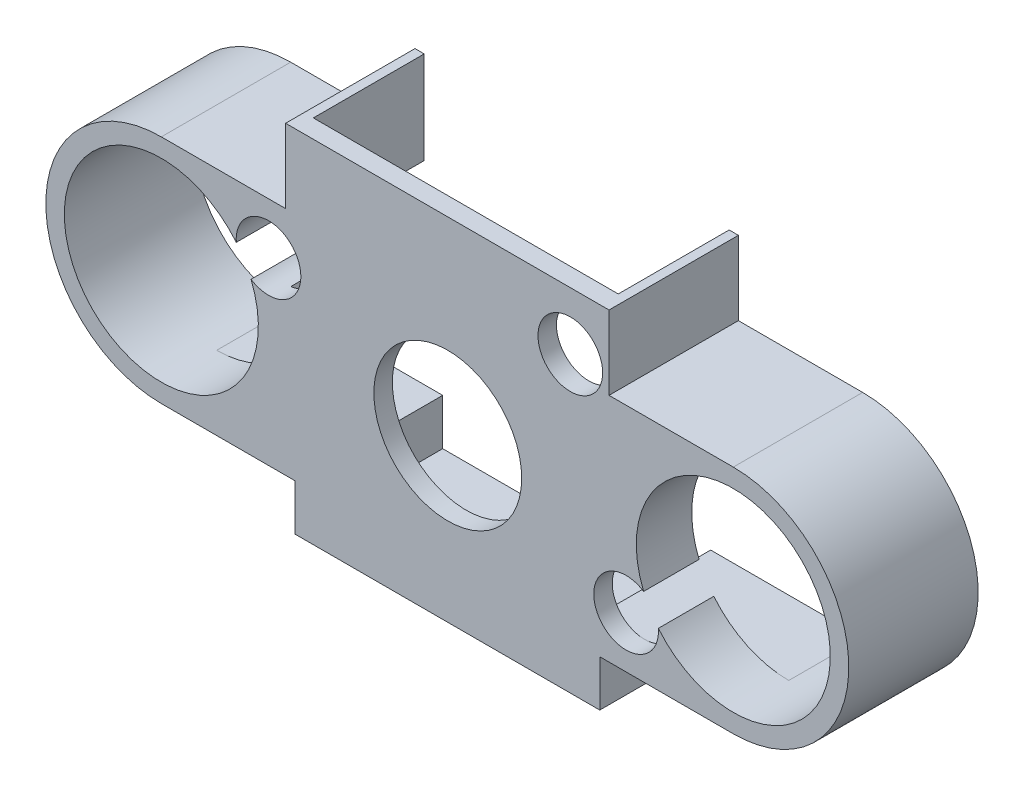
from build123d import *

# Parameters (mm, degrees)
FRONT_PLATE_DEPTH                   = 2
SHELL_DEPTH                         = 12
SHELL_HOLLOW_DEPTH                  = 12
SK_IRRINGS_R                        = 12.5
SK_IRRINGS_R_2                      = 10.5
IR_LED_RINGS_DEPTH                  = 4
LENS_LDR_AND_IR_OPENINGS_DEPTH      = 53.792538299
LENS_LDR_AND_IR_OPENINGS_DEPTH_BACK = 53.792538299
SK_FRONTOPENINGS_R                  = 8
SK_FRONTOPENINGS_R_2                = 3.5
SK_FRONTOPENINGS_R_3                = 10.5
IR_BOARD_NOTCHES_DEPTH              = 53.792538299
IR_BOARD_NOTCHES_DEPTH_BACK         = 53.792538299
SK_IRNOTCHES_R                      = 3.5


with BuildPart() as part:
    # Sk_FrontPlate → Front Plate (new body)
    with BuildSketch(Plane.XY.offset(3)):
        with BuildLine():
            Line((29.79, 18), (16.34, 18))
            Line((16.34, 18), (16.34, 26))
            Line((16.34, 26), (-18.66, 26))
            Line((-18.66, 26), (-18.66, 18))
            Line((-18.66, 18), (-32.11, 18))
            ThreePointArc((-32.11, 18), (-44.61, 5.5), (-32.11, -7))
            Line((-32.11, -7), (-17.66, -7))
            Line((-17.66, -7), (-17.66, -12))
            Line((-17.66, -12), (15.34, -12))
            Line((15.34, -12), (15.34, -7))
            Line((15.34, -7), (29.79, -7))
            ThreePointArc((29.79, -7), (42.29, 5.5), (29.79, 18))
        make_face()
    extrude(amount=-FRONT_PLATE_DEPTH)

    # Sk_ShellOuter → Shell (add)
    with BuildSketch(Plane.XY.offset(1)):
        with BuildLine():
            Line((29.79, 18), (16.34, 18))
            Line((16.34, 18), (16.34, 26))
            Line((16.34, 26), (-18.66, 26))
            Line((-18.66, 26), (-18.66, 18))
            Line((-18.66, 18), (-32.11, 18))
            ThreePointArc((-32.11, 18), (-44.61, 5.5), (-32.11, -7))
            Line((-32.11, -7), (-17.66, -7))
            Line((-17.66, -7), (-17.66, -12))
            Line((-17.66, -12), (15.34, -12))
            Line((15.34, -12), (15.34, -7))
            Line((15.34, -7), (29.79, -7))
            ThreePointArc((29.79, -7), (42.29, 5.5), (29.79, 18))
        make_face()
    extrude(amount=-SHELL_DEPTH)

    # Sk_ShellInner → Shell Hollow (cut)
    with BuildSketch(Plane.XY.offset(1)):
        with BuildLine():
            Line((29.79, 16), (15.34, 16))
            Line((15.34, 16), (15.34, 27))
            Line((15.34, 27), (-17.66, 27))
            Line((-17.66, 27), (-17.66, 16))
            Line((-17.66, 16), (-32.11, 16))
            ThreePointArc((-32.11, 16), (-42.61, 5.5), (-32.11, -5))
            Line((-32.11, -5), (-15.66, -5))
            Line((-15.66, -5), (-15.66, -10))
            Line((-15.66, -10), (13.34, -10))
            Line((13.34, -10), (13.34, -5))
            Line((13.34, -5), (29.79, -5))
            ThreePointArc((29.79, -5), (40.29, 5.5), (29.79, 16))
        make_face()
    extrude(amount=-SHELL_HOLLOW_DEPTH, mode=Mode.SUBTRACT)

    # Sk_IRRings → IR LED Rings (add)
    # profile 1 of 2: a face of its own
    with BuildSketch(Plane.XY.offset(1)):
        with Locations((-32.11, 5.5)):
            Circle(SK_IRRINGS_R)
        with Locations((-32.11, 5.5)):
            Circle(SK_IRRINGS_R_2, mode=Mode.SUBTRACT)
    # profile 2 of 2: a face of its own
    with BuildSketch(Plane.XY.offset(1)):
        with Locations((29.79, 5.5)):
            Circle(SK_IRRINGS_R)
        with Locations((29.79, 5.5)):
            Circle(SK_IRRINGS_R_2, mode=Mode.SUBTRACT)
    extrude(amount=-IR_LED_RINGS_DEPTH)

    # Sk_FrontOpenings → Lens, LDR and IR Openings (cut, two sides: drawn at the far end of the back side and taken through both)
    with BuildSketch(Plane.XY.offset(-LENS_LDR_AND_IR_OPENINGS_DEPTH_BACK)):
        with Locations((-1.11, 5.5)):
            Circle(SK_FRONTOPENINGS_R)
        with Locations((12.15, 19.76)):
            Circle(SK_FRONTOPENINGS_R_2)
        with Locations((-32.11, 5.5)):
            Circle(SK_FRONTOPENINGS_R_3)
        with Locations((29.79, 5.5)):
            Circle(SK_FRONTOPENINGS_R_3)
    extrude(amount=LENS_LDR_AND_IR_OPENINGS_DEPTH + LENS_LDR_AND_IR_OPENINGS_DEPTH_BACK, mode=Mode.SUBTRACT)

    # Sk_IRNotches → IR Board Notches (cut, two sides: drawn at the far end of the back side and taken through both)
    with BuildSketch(Plane.XY.offset(-IR_BOARD_NOTCHES_DEPTH_BACK)):
        with Locations((-20.51, 12.45)):
            Circle(SK_IRNOTCHES_R)
        with Locations((18.19, -1.45)):
            Circle(SK_IRNOTCHES_R)
    extrude(amount=IR_BOARD_NOTCHES_DEPTH + IR_BOARD_NOTCHES_DEPTH_BACK, mode=Mode.SUBTRACT)


solid = part.part
